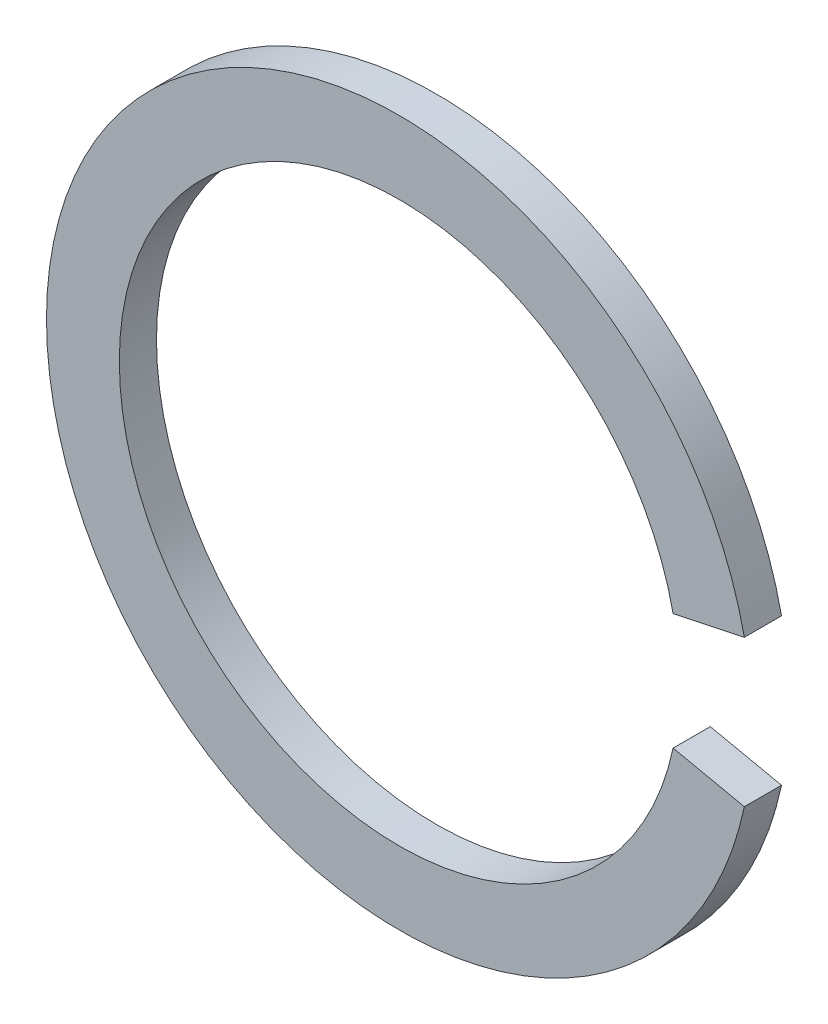
from build123d import *

# Parameters (mm, degrees)
F_01_OPEN_SPRING_STEEL_RETAINER_DEPTH = 0.75


with BuildPart() as part:
    # S01 - Open spring steel retainer → 01 - Open spring steel retainer (new body)
    with BuildSketch(Plane.XY):
        with BuildLine():
            Line((5.526533944, 1.174701053), (6.964410917, 1.480331239))
            ThreePointArc((6.964410917, 1.480331239), (-7.12, 0), (6.964410917, -1.480331239))
            Line((6.964410917, -1.480331239), (5.526533944, -1.174701053))
            ThreePointArc((5.526533944, -1.174701053), (-5.65, 0), (5.526533944, 1.174701053))
        make_face()
    extrude(amount=F_01_OPEN_SPRING_STEEL_RETAINER_DEPTH)


solid = part.part
